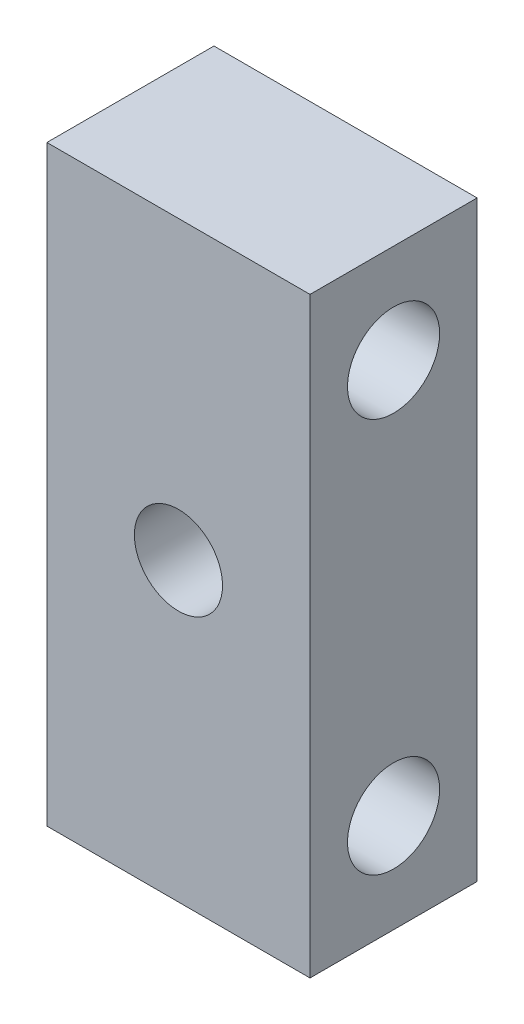
from build123d import *

# Parameters (mm, degrees)
SKETCH1_W           = 20
SKETCH1_H           = 45
BOSS_EXTRUDE1_DEPTH = 12.7
SKETCH2_R           = 3.35
CUT_EXTRUDE1_DEPTH  = 28.704512268
SKETCH3_R           = 3.5
CUT_EXTRUDE2_DEPTH  = 33.673230633


with BuildPart() as part:
    # Sketch1 → Boss-Extrude1 (new body)
    with BuildSketch(Plane.XY):
        Rectangle(SKETCH1_W, SKETCH1_H)
    extrude(amount=BOSS_EXTRUDE1_DEPTH)

    # Sketch2 → Cut-Extrude1 (cut, through all)
    with BuildSketch(Plane.XY.offset(12.7)):
        Circle(SKETCH2_R)
    extrude(amount=-CUT_EXTRUDE1_DEPTH, mode=Mode.SUBTRACT)

    # Sketch3 → Cut-Extrude2 (cut, through all)
    with BuildSketch(Plane(origin=(10, 0, 0), x_dir=(0, 0, -1), z_dir=(1, 0, 0))):
        with Locations((-6.35, 15)):
            Circle(SKETCH3_R)
        with Locations((-6.35, -15)):
            Circle(SKETCH3_R)
    extrude(amount=-CUT_EXTRUDE2_DEPTH, mode=Mode.SUBTRACT)


solid = part.part
